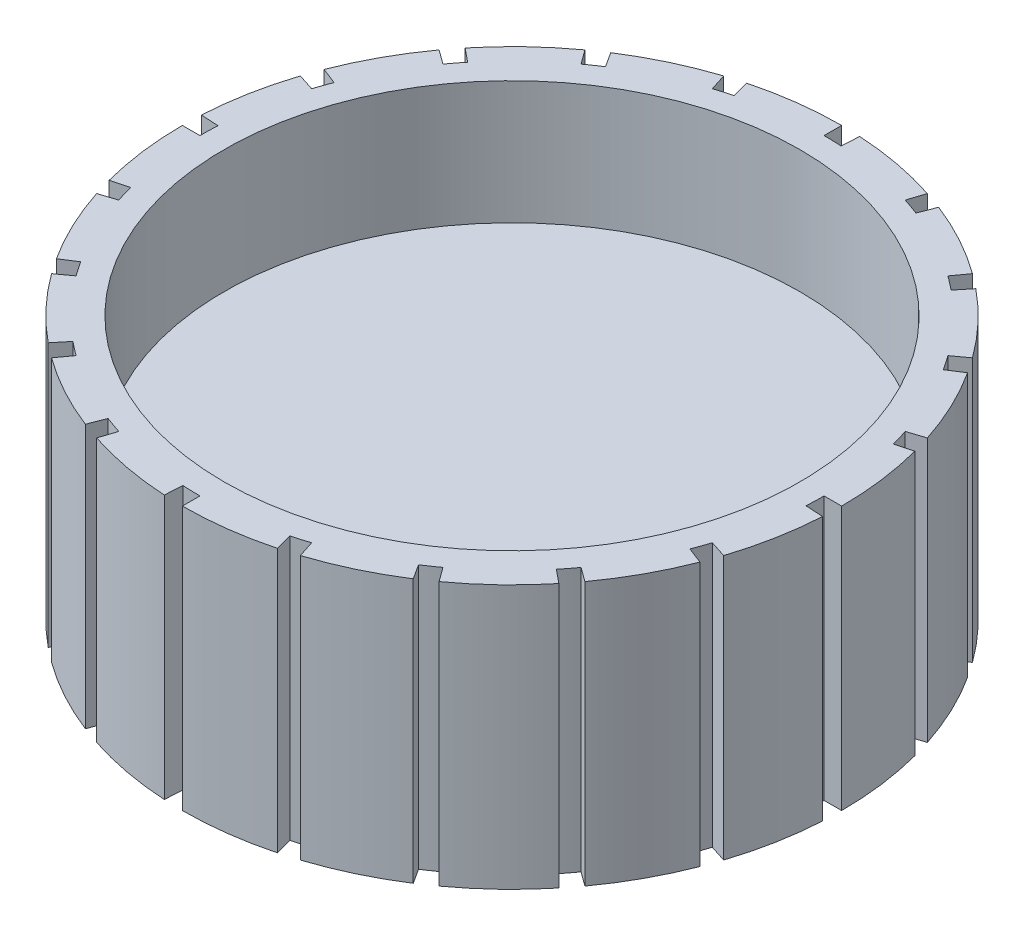
from build123d import *

# Parameters (mm, degrees)
SKETCH_1_R          = 37.5
EXTRUDE_1_DEPTH     = 30
SKETCH_2_R          = 32.75
CUT_EXTRUDE_1_DEPTH = 14
CUT_EXTRUDE_2_DEPTH = 61.930288035


with BuildPart() as part:
    # 草图1 → 凸台-拉伸1 (new body)
    with BuildSketch(Plane(origin=(0, 0, 0), x_dir=(1, 0, 0), z_dir=(0, 1, 0))):
        with Locations(Location((0, 0, 0), (0, 0, 270))):
            Circle(SKETCH_1_R)
    extrude(amount=EXTRUDE_1_DEPTH)

    # 草图2 → 切除-拉伸1 (cut)
    with BuildSketch(Plane(origin=(0, 30, 0), x_dir=(1, 0, 0), z_dir=(0, 1, 0))):
        with Locations(Location((0, 0, 0), (0, 0, 270))):
            Circle(SKETCH_2_R)
    extrude(amount=-CUT_EXTRUDE_1_DEPTH, mode=Mode.SUBTRACT)

    # 草图3 → 切除-拉伸2 (cut, through all)
    with BuildSketch(Plane(origin=(0, 30, 0), x_dir=(1, 0, 0), z_dir=(0, 1, 0))):
        with BuildLine():
            Line((-35.443617197, 2), (-37.440440701, 2.112676056))
            ThreePointArc((-37.440440701, 2.112676056), (-37.485107218, 1.05675771), (-37.5, 0))
            Line((-37.5, 0), (-35.5, 0))
            ThreePointArc((-35.5, 0), (-35.4859015, 1.000397299), (-35.443617197, 2))
        make_face()
        with BuildLine():
            Line((-33.762506328, 10.9701033), (-35.664619361, 11.588137289))
            ThreePointArc((-35.664619361, 11.588137289), (-35.323899392, 12.588571472), (-34.955122297, 13.579006784))
            Line((-34.955122297, 13.579006784), (-33.090849107, 12.854793089))
            ThreePointArc((-33.090849107, 12.854793089), (-33.439958091, 11.917180994), (-33.762506328, 10.9701033))
        make_face()
        with BuildLine():
            Line((-28.7201033, 20.866376456), (-30.338137289, 22.041946961))
            ThreePointArc((-30.338137289, 22.041946961), (-29.704942178, 22.88812815), (-29.048152975, 23.716129717))
            Line((-29.048152975, 23.716129717), (-27.49891815, 22.451269465))
            ThreePointArc((-27.49891815, 22.451269465), (-28.120678595, 21.667427982), (-28.7201033, 20.866376456))
        make_face()
        with BuildLine():
            Line((-20.866376456, 28.7201033), (-22.041946961, 30.338137289))
            ThreePointArc((-22.041946961, 30.338137289), (-21.178258257, 30.947235372), (-20.29774805, 31.531752633))
            Line((-20.29774805, 31.531752633), (-19.215201487, 29.850059159))
            ThreePointArc((-19.215201487, 29.850059159), (-20.04875115, 29.296716153), (-20.866376456, 28.7201033))
        make_face()
        with BuildLine():
            Line((-10.9701033, 33.762506328), (-11.588137289, 35.664619361))
            ThreePointArc((-11.588137289, 35.664619361), (-10.57849886, 35.977011575), (-9.560458123, 36.260827907))
            Line((-9.560458123, 36.260827907), (-9.050567023, 34.326917085))
            ThreePointArc((-9.050567023, 34.326917085), (-10.014312254, 34.058237624), (-10.9701033, 33.762506328))
        make_face()
        with BuildLine():
            Line((0, 35.5), (0, 37.5))
            ThreePointArc((0, 37.5), (1.05675771, 37.485107218), (2.112676056, 37.440440701))
            Line((2.112676056, 37.440440701), (2, 35.443617197))
            ThreePointArc((2, 35.443617197), (1.000397299, 35.4859015), (0, 35.5))
        make_face()
        with BuildLine():
            Line((10.9701033, 33.762506328), (11.588137289, 35.664619361))
            ThreePointArc((11.588137289, 35.664619361), (12.588571472, 35.323899392), (13.579006784, 34.955122297))
            Line((13.579006784, 34.955122297), (12.854793089, 33.090849107))
            ThreePointArc((12.854793089, 33.090849107), (11.917180994, 33.439958091), (10.9701033, 33.762506328))
        make_face()
        with BuildLine():
            Line((20.866376456, 28.7201033), (22.041946961, 30.338137289))
            ThreePointArc((22.041946961, 30.338137289), (22.88812815, 29.704942178), (23.716129717, 29.048152975))
            Line((23.716129717, 29.048152975), (22.451269465, 27.49891815))
            ThreePointArc((22.451269465, 27.49891815), (21.667427982, 28.120678595), (20.866376456, 28.7201033))
        make_face()
        with BuildLine():
            Line((28.7201033, 20.866376456), (30.338137289, 22.041946961))
            ThreePointArc((30.338137289, 22.041946961), (30.947235372, 21.178258257), (31.531752633, 20.29774805))
            Line((31.531752633, 20.29774805), (29.850059159, 19.215201487))
            ThreePointArc((29.850059159, 19.215201487), (29.296716153, 20.04875115), (28.7201033, 20.866376456))
        make_face()
        with BuildLine():
            Line((33.762506328, 10.9701033), (35.664619361, 11.588137289))
            ThreePointArc((35.664619361, 11.588137289), (35.977011575, 10.57849886), (36.260827907, 9.560458123))
            Line((36.260827907, 9.560458123), (34.326917085, 9.050567023))
            ThreePointArc((34.326917085, 9.050567023), (34.058237624, 10.014312254), (33.762506328, 10.9701033))
        make_face()
        with BuildLine():
            Line((35.5, 0), (37.5, 0))
            ThreePointArc((37.5, 0), (37.485107218, -1.05675771), (37.440440701, -2.112676056))
            Line((37.440440701, -2.112676056), (35.443617197, -2))
            ThreePointArc((35.443617197, -2), (35.4859015, -1.000397299), (35.5, 0))
        make_face()
        with BuildLine():
            Line((33.762506328, -10.9701033), (35.664619361, -11.588137289))
            ThreePointArc((35.664619361, -11.588137289), (35.323899392, -12.588571472), (34.955122297, -13.579006784))
            Line((34.955122297, -13.579006784), (33.090849107, -12.854793089))
            ThreePointArc((33.090849107, -12.854793089), (33.439958091, -11.917180994), (33.762506328, -10.9701033))
        make_face()
        with BuildLine():
            Line((28.7201033, -20.866376456), (30.338137289, -22.041946961))
            ThreePointArc((30.338137289, -22.041946961), (29.704942178, -22.88812815), (29.048152975, -23.716129717))
            Line((29.048152975, -23.716129717), (27.49891815, -22.451269465))
            ThreePointArc((27.49891815, -22.451269465), (28.120678595, -21.667427982), (28.7201033, -20.866376456))
        make_face()
        with BuildLine():
            Line((20.866376456, -28.7201033), (22.041946961, -30.338137289))
            ThreePointArc((22.041946961, -30.338137289), (21.178258257, -30.947235372), (20.29774805, -31.531752633))
            Line((20.29774805, -31.531752633), (19.215201487, -29.850059159))
            ThreePointArc((19.215201487, -29.850059159), (20.04875115, -29.296716153), (20.866376456, -28.7201033))
        make_face()
        with BuildLine():
            Line((10.9701033, -33.762506328), (11.588137289, -35.664619361))
            ThreePointArc((11.588137289, -35.664619361), (10.57849886, -35.977011575), (9.560458123, -36.260827907))
            Line((9.560458123, -36.260827907), (9.050567023, -34.326917085))
            ThreePointArc((9.050567023, -34.326917085), (10.014312254, -34.058237624), (10.9701033, -33.762506328))
        make_face()
        with BuildLine():
            Line((0, -35.5), (0, -37.5))
            ThreePointArc((0, -37.5), (-1.05675771, -37.485107218), (-2.112676056, -37.440440701))
            Line((-2.112676056, -37.440440701), (-2, -35.443617197))
            ThreePointArc((-2, -35.443617197), (-1.000397299, -35.4859015), (0, -35.5))
        make_face()
        with BuildLine():
            Line((-10.9701033, -33.762506328), (-11.588137289, -35.664619361))
            ThreePointArc((-11.588137289, -35.664619361), (-12.588571472, -35.323899392), (-13.579006784, -34.955122297))
            Line((-13.579006784, -34.955122297), (-12.854793089, -33.090849107))
            ThreePointArc((-12.854793089, -33.090849107), (-11.917180994, -33.439958091), (-10.9701033, -33.762506328))
        make_face()
        with BuildLine():
            Line((-20.866376456, -28.7201033), (-22.041946961, -30.338137289))
            ThreePointArc((-22.041946961, -30.338137289), (-22.88812815, -29.704942178), (-23.716129717, -29.048152975))
            Line((-23.716129717, -29.048152975), (-22.451269465, -27.49891815))
            ThreePointArc((-22.451269465, -27.49891815), (-21.667427982, -28.120678595), (-20.866376456, -28.7201033))
        make_face()
        with BuildLine():
            Line((-28.7201033, -20.866376456), (-30.338137289, -22.041946961))
            ThreePointArc((-30.338137289, -22.041946961), (-30.947235372, -21.178258257), (-31.531752633, -20.29774805))
            Line((-31.531752633, -20.29774805), (-29.850059159, -19.215201487))
            ThreePointArc((-29.850059159, -19.215201487), (-29.296716153, -20.04875115), (-28.7201033, -20.866376456))
        make_face()
        with BuildLine():
            Line((-33.762506328, -10.9701033), (-35.664619361, -11.588137289))
            ThreePointArc((-35.664619361, -11.588137289), (-35.977011575, -10.57849886), (-36.260827907, -9.560458123))
            Line((-36.260827907, -9.560458123), (-34.326917085, -9.050567023))
            ThreePointArc((-34.326917085, -9.050567023), (-34.058237624, -10.014312254), (-33.762506328, -10.9701033))
        make_face()
    extrude(amount=-CUT_EXTRUDE_2_DEPTH, mode=Mode.SUBTRACT)


solid = part.part
